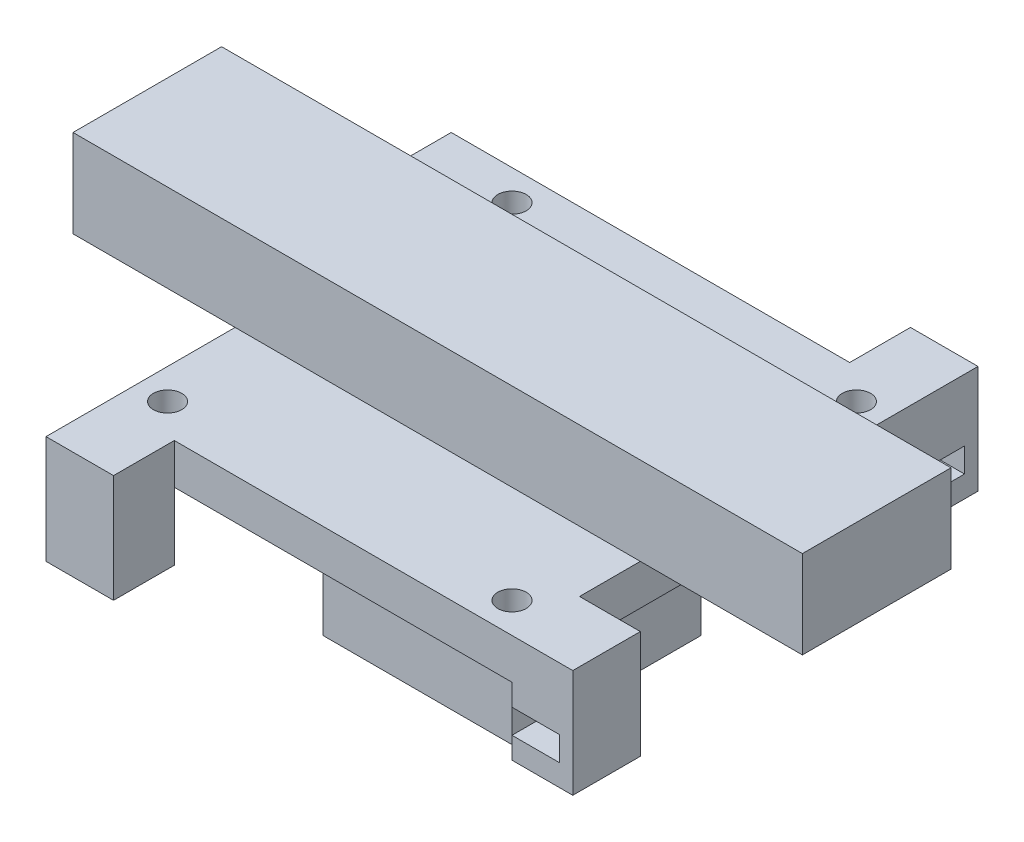
from build123d import *

# Parameters (mm, degrees)
BOSS_EXTRUDE1_DEPTH = 3
SKETCH8_R           = 1.05
CUT_EXTRUDE1_DEPTH  = 28.739863013
SKETCH9_R           = 7.5
CUT_EXTRUDE2_DEPTH  = 2
SKETCH10_W          = 5
SKETCH10_H          = 4.5
SKETCH10_W_2        = 4.5
SKETCH10_H_2        = 5
BOSS_EXTRUDE2_DEPTH = 5
SKETCH11_R          = 0.6
CUT_EXTRUDE3_DEPTH  = 6
CUT_EXTRUDE4_DEPTH  = 3.5
CIRPATTERN1_COUNT   = 4
SKETCH15_W          = 3.5
SKETCH15_H          = 1.8
CUT_EXTRUDE5_DEPTH  = 4.2
CIRPATTERN2_COUNT   = 4
SKETCH16_W          = 14.5
SKETCH16_H          = 14.5
CUT_EXTRUDE6_DEPTH  = 2
FILLET1_R           = 0.4
SKETCH17_W          = 14
SKETCH17_H          = 14
BOSS_EXTRUDE3_DEPTH = 14
SKETCH18_W          = 54
SKETCH18_H          = 11
BOSS_EXTRUDE4_DEPTH = 6.5


with BuildPart() as part:
    # Sketch1 → Boss-Extrude1 (new body)
    with BuildSketch(Plane(origin=(0, 0, 0), x_dir=(1, 0, 0), z_dir=(0, 1, 0))):
        Polygon((19.5, -15), (19.5, -10), (15, -10), (15, 19.5), (10, 19.5), (10, 15), (-19.5, 15), (-19.5, 10), (-15, 10), (-15, -19.5), (-10, -19.5), (-10, -15), align=None)
    extrude(amount=BOSS_EXTRUDE1_DEPTH)

    # Sketch8 → Cut-Extrude1 (cut, through all)
    with BuildSketch(Plane(origin=(0, 0, 0), x_dir=(-1, 0, 0), z_dir=(0, -1, 0))):
        with Locations(Location((-12.75, 12.75, 0), (0, 0, 90))):
            Circle(SKETCH8_R)
        with Locations(Location((12.75, 12.75, 0), (0, 0, 90))):
            Circle(SKETCH8_R)
        with Locations(Location((12.75, -12.75, 0), (0, 0, 90))):
            Circle(SKETCH8_R)
        with Locations(Location((-12.75, -12.75, 0), (0, 0, 90))):
            Circle(SKETCH8_R)
    extrude(amount=-CUT_EXTRUDE1_DEPTH, mode=Mode.SUBTRACT)

    # Sketch9 → Cut-Extrude2 (cut)
    with BuildSketch(Plane(origin=(0, 0, 0), x_dir=(-1, 0, 0), z_dir=(0, -1, 0))):
        with Locations(Location((0, 0, 0), (0, 0, 90))):
            Circle(SKETCH9_R)
    extrude(amount=-CUT_EXTRUDE2_DEPTH, mode=Mode.SUBTRACT)

    # Sketch10 → Boss-Extrude2 (add)
    with BuildSketch(Plane.XZ):
        with Locations((-12.5, 17.25)):
            Rectangle(SKETCH10_W, SKETCH10_H)
        with Locations((-17.25, -12.5)):
            Rectangle(SKETCH10_W_2, SKETCH10_H_2)
        with Locations((12.5, -17.25)):
            Rectangle(SKETCH10_W, SKETCH10_H)
        with Locations((17.25, 12.5)):
            Rectangle(SKETCH10_W_2, SKETCH10_H_2)
    extrude(amount=BOSS_EXTRUDE2_DEPTH)

    # Sketch11 → Cut-Extrude3 (cut)
    with BuildSketch(Plane.XZ.offset(5)):
        with Locations(Location((-12.5, 17.25, 0), (0, 0, 270))):
            Circle(SKETCH11_R)
    cut_extrude3 = extrude(amount=-CUT_EXTRUDE3_DEPTH, mode=Mode.SUBTRACT)

    # Sketch13 → Cut-Extrude4 (cut)
    with BuildSketch(Plane(origin=(0, 0, 15), x_dir=(-1, 0, 0), z_dir=(0, 0, -1))):
        Polygon((10.85, -3.4), (14.15, -3.4), (15, -3.4), (15, -1.6), (14.15, -1.6), (10.85, -1.6), align=None)
    cut_extrude4 = extrude(amount=-CUT_EXTRUDE4_DEPTH, mode=Mode.SUBTRACT)

    # CirPattern1: Cut-Extrude3, Cut-Extrude4 ×4 about axis
    cirpattern1_axis = Axis((0, 0, 0), (0, 1, 0))
    add([cut_extrude3.rotate(cirpattern1_axis, i * 360 / CIRPATTERN1_COUNT) for i in range(1, CIRPATTERN1_COUNT)], mode=Mode.SUBTRACT)
    add([cut_extrude4.rotate(cirpattern1_axis, i * 360 / CIRPATTERN1_COUNT) for i in range(1, CIRPATTERN1_COUNT)], mode=Mode.SUBTRACT)

    # Sketch15 → Cut-Extrude5 (cut)
    with BuildSketch(Plane.XY.offset(15)):
        with Locations((16.75, -2.5)):
            Rectangle(SKETCH15_W, SKETCH15_H)
    cut_extrude5 = extrude(amount=-CUT_EXTRUDE5_DEPTH, mode=Mode.SUBTRACT)

    # CirPattern2: Cut-Extrude5 ×4 about axis
    cirpattern2_axis = Axis((0, 0, 0), (0, 1, 0))
    for i in range(1, CIRPATTERN2_COUNT):
        add(cut_extrude5.rotate(cirpattern2_axis, i * 360 / CIRPATTERN2_COUNT), mode=Mode.SUBTRACT)

    # Sketch16 → Cut-Extrude6 (cut)
    with BuildSketch(Plane.XZ):
        Rectangle(SKETCH16_W, SKETCH16_H)
    extrude(amount=-CUT_EXTRUDE6_DEPTH, mode=Mode.SUBTRACT)

    # Fillet1
    fillet1_edges = [part.edges().sort_by_distance(p)[0] for p in [
        (7.25, 1, 7.25),
        (7.25, 1, -7.25),
        (-7.25, 1, -7.25),
        (-7.25, 1, 7.25),
    ]]
    fillet(fillet1_edges, radius=FILLET1_R)

    # Sketch17 → Boss-Extrude3 (add)
    with BuildSketch(Plane.XZ.offset(-2)):
        Rectangle(SKETCH17_W, SKETCH17_H)
    extrude(amount=BOSS_EXTRUDE3_DEPTH)

    # Sketch18 → Boss-Extrude4 (add)
    with BuildSketch(Plane(origin=(0, 3, 0), x_dir=(1, 0, 0), z_dir=(0, 1, 0))):
        Rectangle(SKETCH18_W, SKETCH18_H)
    extrude(amount=BOSS_EXTRUDE4_DEPTH)


solid = part.part
